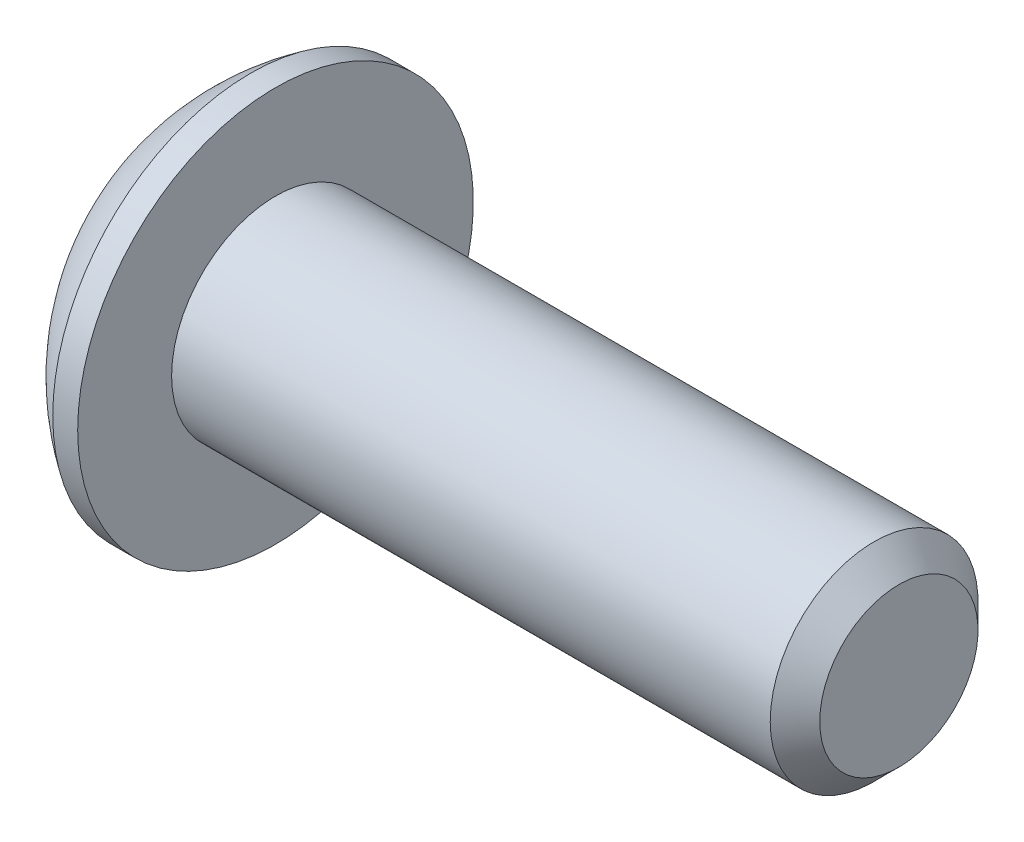
from build123d import *

# Parameters (mm, degrees)
HEX_2_DEPTH = 1.1176


with BuildPart() as part:
    # BodySke → BaseBody (revolve)
    with BuildSketch(Plane.XY, mode=Mode.PRIVATE) as basebody_sk:
        with BuildLine():
            Line((11.2014, 0), (11.2014, 1.20904))
            Line((11.2014, 1.20904), (10.82294, 1.5875))
            Line((10.82294, 1.5875), (1.6764, 1.5875))
            Line((1.6764, 1.5875), (1.6764, 3.0226))
            Line((1.6764, 3.0226), (1.2954, 3.0226))
            ThreePointArc((1.2954, 3.0226), (0.541867481, 2.357663588), (0, 1.5113))
            Line((0, 1.5113), (0, 0))
            Line((0, 0), (11.2014, 0))
        make_face()
    revolve(basebody_sk.sketch.rotate(Axis((0, 0, 0), (1, 0, 0)), 90), axis=Axis((0, 0, 0), (1, 0, 0)))

    # Sketch2 → PreBroach (revolve, cut)
    with BuildSketch(Plane.XY, mode=Mode.PRIVATE) as prebroach_sk:
        Polygon((0, 0.9906), (1.1176, 0.9906), (1.689523177, 0), (0, 0), align=None)
    revolve(prebroach_sk.sketch.rotate(Axis((0, 0, 0), (1, 0, 0)), 90), axis=Axis((0, 0, 0), (1, 0, 0)), mode=Mode.SUBTRACT)

    # Sketch3 → Hex 2 (cut)
    with BuildSketch(Plane(origin=(0, 0, 0), x_dir=(0, 0, -1), z_dir=(1, 0, 0))):
        Polygon((-0.9906, -0.571923177), (-0.9906, 0.571923177), (0, 1.143846353), (0.9906, 0.571923177), (0.9906, -0.571923177), (0, -1.143846353), align=None)
    extrude(amount=HEX_2_DEPTH, mode=Mode.SUBTRACT)


solid = part.part
